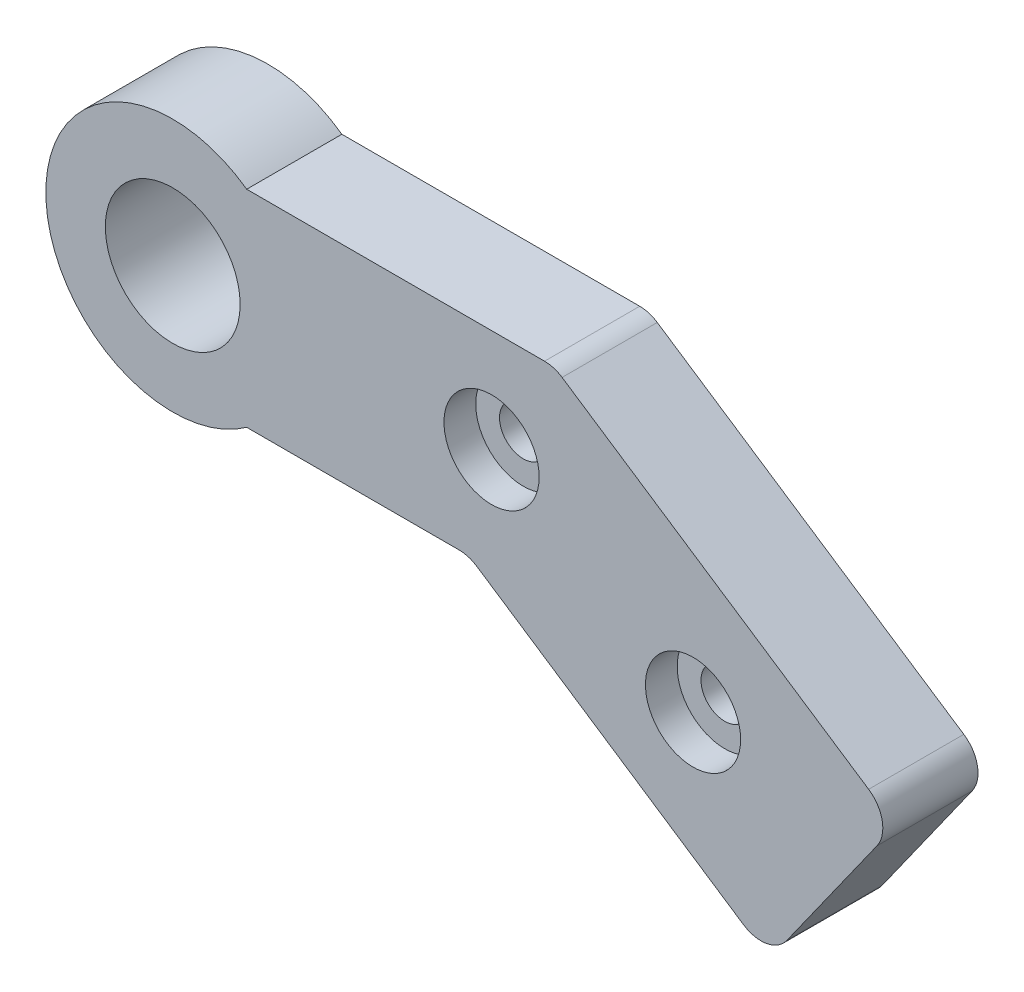
from build123d import *

# Parameters (mm, degrees)
BOSS_EXTRU_1_DEPTH      = 6
CONG_1_R                = 2
ESQUISSE2_R             = 4.25
ESQUISSE2_R_2           = 1.5
ENL_V_MAT_EXTRU_1_DEPTH = 36.585366409
ESQUISSE3_R             = 3
ENL_V_MAT_EXTRU_2_DEPTH = 2


with BuildPart() as part:
    # Esquisse1 → Boss.-Extru.1 (new body)
    with BuildSketch(Plane.XY):
        with BuildLine():
            Line((-16.712083242, 5.657318013), (2.667916758, 5.657318013))
            Line((2.667916758, 5.657318013), (24.215038011, -8.640953678))
            Line((24.215038011, -8.640953678), (16.21948516, -19.905321115))
            Line((16.21948516, -19.905321115), (-2.712083242, -7.342681987))
            Line((-2.712083242, -7.342681987), (-16.712083242, -7.342681987))
            ThreePointArc((-16.712083242, -7.342681987), (-29.375772768, -0.842681987), (-16.712083242, 5.657318013))
        make_face()
    extrude(amount=BOSS_EXTRU_1_DEPTH)

    # Congé1
    cong_1_edges = [part.edges().sort_by_distance(p)[0] for p in [
        (2.667916758, 5.657318013, 3),
        (24.215038011, -8.640953678, 3),
        (16.21948516, -19.905321115, 3),
        (-2.712083242, -7.342681987, 3),
    ]]
    fillet(cong_1_edges, radius=CONG_1_R)

    # Esquisse2 → Enlèv. mat.-Extru.1 (cut, through all)
    with BuildSketch(Plane.XY.offset(6)):
        with Locations((-21.375772768, -0.842681987)):
            Circle(ESQUISSE2_R)
        with Locations((-1.275772768, -0.842681987)):
            Circle(ESQUISSE2_R_2)
        with Locations((11.425197336, -8.822992659)):
            Circle(ESQUISSE2_R_2)
    extrude(amount=-ENL_V_MAT_EXTRU_1_DEPTH, mode=Mode.SUBTRACT)

    # Esquisse3 → Enlèv. mat.-Extru.2 (cut)
    with BuildSketch(Plane.XY.offset(6)):
        with Locations((-1.275772768, -0.842681987)):
            Circle(ESQUISSE3_R)
        with Locations((11.425197336, -8.822992659)):
            Circle(ESQUISSE3_R)
    extrude(amount=-ENL_V_MAT_EXTRU_2_DEPTH, mode=Mode.SUBTRACT)


solid = part.part
